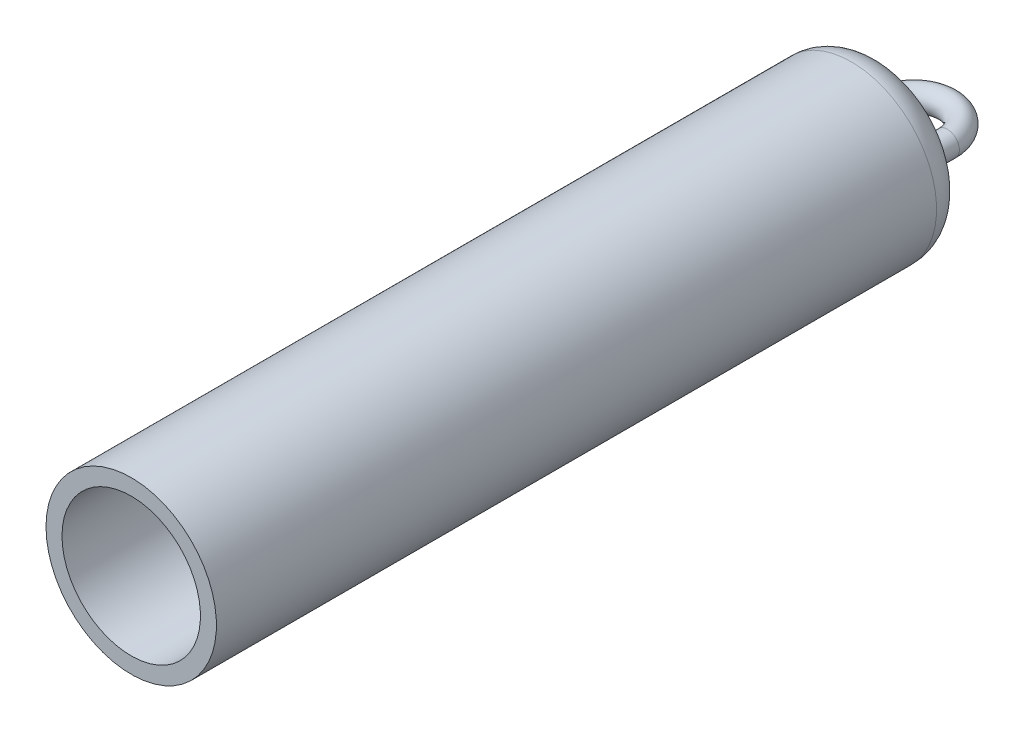
from build123d import *

# Parameters (mm, degrees)
ESQUISSE2_R        = 10.65
ESQUISSE2_R_2      = 8.65
BOSS_EXTRU_1_DEPTH = 45
ESQUISSE5_R        = 1.5


with BuildPart() as part:
    # Esquisse2 → Boss.-Extru.1 (new, symmetric)
    with BuildSketch(Plane.XY):
        with Locations(Location((0, 0, 0), (0, 0, 180))):
            Circle(ESQUISSE2_R)
        with Locations(Location((0, 0, 0), (0, 0, 180))):
            Circle(ESQUISSE2_R_2, mode=Mode.SUBTRACT)
    extrude(amount=BOSS_EXTRU_1_DEPTH, both=True)

    # Esquisse3 → Révolution1 (revolve)
    with BuildSketch(Plane(origin=(0, 0, 0), x_dir=(1, 0, 0), z_dir=(0, 1, 0))):
        with BuildLine():
            Line((-6.65, 49), (0, 49))
            Line((0, 49), (0, 45))
            Line((0, 45), (-10.65, 45))
            ThreePointArc((-10.65, 45), (-9.478427125, 47.828427125), (-6.65, 49))
        make_face()
    revolve(axis=Axis((0, 0, -49), (0, 0, 1)))

    # Balayage3: sweep along a path in Esquisse6
    with BuildLine(Plane(origin=(0, 0, 0), x_dir=(1, 0, 0), z_dir=(0, 1, 0))) as balayage3_path:
        Line((-2.65, 45), (-2.65, 52.85))
        ThreePointArc((-2.65, 52.85), (0, 55.5), (2.65, 52.85))
        Line((2.65, 52.85), (2.65, 45))
    # Esquisse5 → Balayage3 (sweep)
    with BuildSketch(Plane(origin=(0, 0, 0), x_dir=(0, 0, -1), z_dir=(1, 0, 0))):
        with Locations((57, 0)):
            Circle(ESQUISSE5_R)
    sweep(path=balayage3_path.line)


solid = part.part
